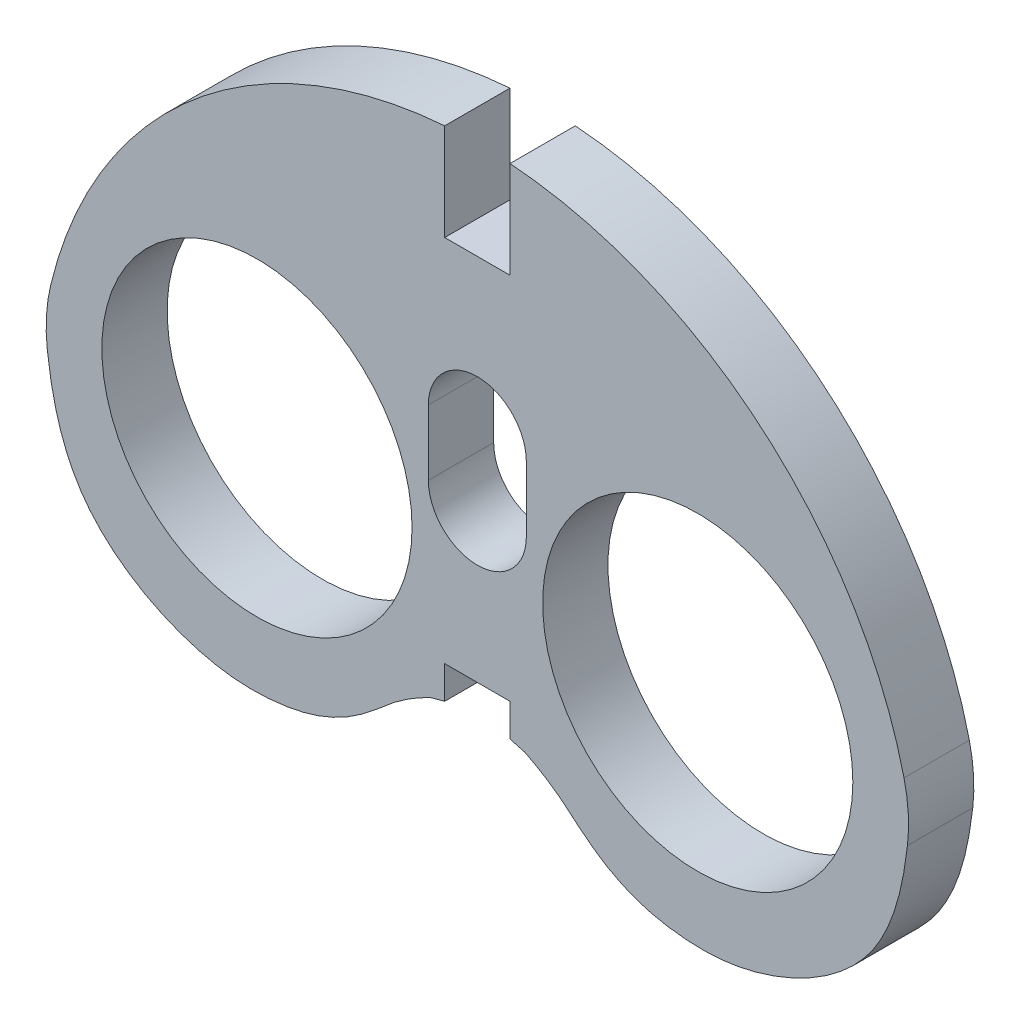
from build123d import *

# Parameters (mm, degrees)
ESTRUSIONE_ESTRUSIONE1_DEPTH = 4
RACCORDO1_R                  = 10
RACCORDO2_R                  = 10


with BuildPart() as part:
    # Schizzo1 → Estrusione-Estrusione1 (new body)
    with BuildSketch(Plane.XY):
        with BuildLine():
            ThreePointArc((-23, 0), (-13.5, 9.5), (-4, 0))
            Line((-4, 0), (-1, 0))
            ThreePointArc((-1, 0), (-1.000295828, 0.085997792), (-1.001183299, 0.171991513))
            ThreePointArc((-1.001183299, 0.171991513), (-2.449852026, 1.268461652), (-3, 3))
            Line((-3, 3), (-3, 6.782329983))
            ThreePointArc((-3, 6.782329983), (-17.035533906, 11.989578808), (-26, 0))
            Line((-26, 0), (-23, 0))
        make_face()
        with BuildLine():
            Line((-1, 0), (-4, 0))
            ThreePointArc((-4, 0), (-13.5, -9.5), (-23, 0))
            Line((-23, 0), (-26, 0))
            ThreePointArc((-26, 0), (-19.090169944, -11.180339887), (-6, -10))
            ThreePointArc((-6, -10), (-2.319660113, -5.590169944), (-1, 0))
        make_face()
        with BuildLine():
            ThreePointArc((-1.001183299, 0.171991513), (-1.000295828, 0.085997792), (-1, 0))
            Line((-1, 0), (-9e-09, 0))
            ThreePointArc((-9e-09, 0), (-0.507924477, 0.043310512), (-1.001183299, 0.171991513))
        make_face()
        with BuildLine():
            Line((-9e-09, 0), (-1, 0))
            ThreePointArc((-1, 0), (-2.319660113, -5.590169944), (-6, -10))
            add(Edge.make_bspline(
                [(-6, -10), (-4.445769188, -8.963846126), (-2.891538377, -8.464499677)],
                knots=[0, 0, 0, 0.259038469, 0.259038469, 0.259038469], degree=2))
            add(Edge.make_bspline(
                [(-2.891538377, -8.464499677), (-2.445769188, -8.321282042), (-2, -8.222222222)],
                knots=[0.259038469, 0.259038469, 0.259038469, 0.333333333, 0.333333333, 0.333333333], degree=2))
            Line((-2, -8.222222222), (-2, -6.222222222))
            Line((-2, -6.222222222), (2, -6.222222222))
            Line((2, -6.222222222), (2, -8.222222222))
            add(Edge.make_bspline(
                [(2, -8.222222222), (2.453171695, -8.322927043), (2.90634339, -8.469268439)],
                knots=[0.666666667, 0.666666667, 0.666666667, 0.742195282, 0.742195282, 0.742195282], degree=2))
            add(Edge.make_bspline(
                [(2.90634339, -8.469268439), (4.453171695, -8.96878113), (6, -10)],
                knots=[0.742195282, 0.742195282, 0.742195282, 1, 1, 1], degree=2))
            ThreePointArc((6, -10), (2.319660113, -5.590169944), (1, 0))
            Line((1, 0), (-9e-09, 0))
        make_face()
        with BuildLine():
            ThreePointArc((-6, -10), (-19.090169944, -11.180339887), (-26, 0))
            Line((-26, 0), (-26.5, 0))
            add(Edge.make_bspline(
                [(-26.5, 0), (-26.289597686, -2.99847523), (-25.218910816, -9.881888417), (-17.201760367, -13.618078309), (-10.427980074, -13.430387712), (-7.346751114, -12.011307512), (-4.709599107, -9.378573644), (-2.891538377, -8.464499677)],
                knots=[0, 0, 0, 0, 0.254741044, 0.563192357, 0.634676404, 0.898097469, 1, 1, 1, 1], degree=3))
            add(Edge.make_bspline(
                [(-6, -10), (-4.445769188, -8.963846126), (-2.891538377, -8.464499677)],
                knots=[0, 0, 0, 0.259038469, 0.259038469, 0.259038469], degree=2))
        make_face()
        with BuildLine():
            Line((-26.5, 0), (-26, 0))
            ThreePointArc((-26, 0), (-17.035533906, 11.989578808), (-3, 6.782329983))
            Line((-3, 6.782329983), (-3, 7))
            ThreePointArc((-3, 7), (0, 10), (3, 7))
            Line((3, 7), (3, 6.782329983))
            ThreePointArc((3, 6.782329983), (17.035533906, 11.989578808), (26, 0))
            Line((26, 0), (26.5, 0))
            ThreePointArc((26.5, 0), (18.095278025, 15.376139293), (2, 22.304850307))
            Line((2, 22.304850307), (2, 16.379360111))
            Line((2, 16.379360111), (-2, 16.379360111))
            Line((-2, 16.379360111), (-2, 22.304850307))
            ThreePointArc((-2, 22.304850307), (-18.095278025, 15.376139293), (-26.5, 0))
        make_face()
        with BuildLine():
            ThreePointArc((1.001183299, 0.171991513), (0.507924468, 0.043310511), (-9e-09, 0))
            Line((-9e-09, 0), (1, 0))
            ThreePointArc((1, 0), (1.000295828, 0.085997792), (1.001183299, 0.171991513))
        make_face()
        with BuildLine():
            ThreePointArc((1.001183299, 0.171991513), (1.000295828, 0.085997792), (1, 0))
            Line((1, 0), (4, 0))
            ThreePointArc((4, 0), (13.5, 9.5), (23, 0))
            Line((23, 0), (26, 0))
            ThreePointArc((26, 0), (17.035533906, 11.989578808), (3, 6.782329983))
            Line((3, 6.782329983), (3, 3))
            ThreePointArc((3, 3), (2.449852026, 1.268461652), (1.001183299, 0.171991513))
        make_face()
        with BuildLine():
            Line((4, 0), (1, 0))
            ThreePointArc((1, 0), (2.319660113, -5.590169944), (6, -10))
            ThreePointArc((6, -10), (19.090169944, -11.180339887), (26, 0))
            Line((26, 0), (23, 0))
            ThreePointArc((23, 0), (13.5, -9.5), (4, 0))
        make_face()
        with BuildLine():
            ThreePointArc((26, 0), (19.090169944, -11.180339887), (6, -10))
            add(Edge.make_bspline(
                [(2.90634339, -8.469268439), (4.453171695, -8.96878113), (6, -10)],
                knots=[0.742195282, 0.742195282, 0.742195282, 1, 1, 1], degree=2))
            add(Edge.make_bspline(
                [(26.5, 0), (26.289638323, -2.998481264), (25.218829564, -9.881876352), (17.20194664, -13.618105968), (10.427790666, -13.430359587), (7.351087048, -12.012249752), (4.709964683, -9.380290908), (2.90634339, -8.469268439)],
                knots=[0, 0, 0, 0, 0.254741044, 0.563192357, 0.634676404, 0.898097469, 0.999864445, 0.999864445, 0.999864445, 0.999864445], degree=3))
            Line((26.5, 0), (26, 0))
        make_face()
    extrude(amount=ESTRUSIONE_ESTRUSIONE1_DEPTH)

    # Raccordo1
    raccordo1_edges = [part.edges().sort_by_distance(p)[0] for p in [
        (-26.5, 0, 2),
    ]]
    fillet(raccordo1_edges, radius=RACCORDO1_R)

    # Raccordo2
    raccordo2_edges = [part.edges().sort_by_distance(p)[0] for p in [
        (26.5, 0, 2),
    ]]
    fillet(raccordo2_edges, radius=RACCORDO2_R)


solid = part.part
